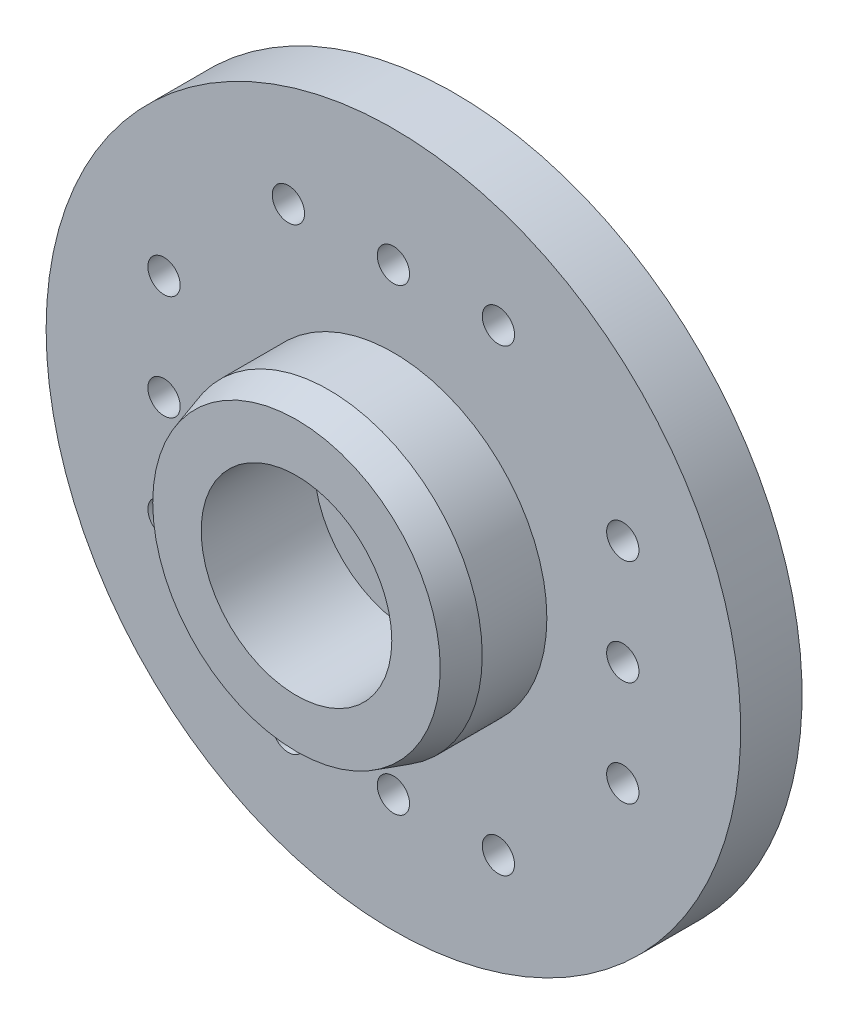
from build123d import *

# Parameters (mm, degrees)
SKETCH1_R           = 10.75
SKETCH1_R_2         = 0.5
BOSS_EXTRUDE1_DEPTH = 1.9
SKETCH2_R           = 4.75
BOSS_EXTRUDE2_DEPTH = 3
SKETCH7_R           = 2.95
CUT_EXTRUDE1_DEPTH  = 3.5
SKETCH8_R           = 3.25
SKETCH8_R_2         = 2.75
BOSS_EXTRUDE3_DEPTH = 1
CUT_EXTRUDE2_START  = -0.4
SKETCH9_R           = 4.25
SKETCH9_R_2         = 3.25
CUT_EXTRUDE2_DEPTH  = 0.4
SKETCH10_R          = 1.45
CUT_EXTRUDE3_DEPTH  = 16.972945877


with BuildPart() as part:
    # Sketch1 → Boss-Extrude1 (new body)
    with BuildSketch(Plane.XY):
        with Locations(Location((0, 0, 0), (0, 0, 180))):
            Circle(SKETCH1_R)
        with Locations((-3.25, 7.1)):
            Circle(SKETCH1_R_2, mode=Mode.SUBTRACT)
        with Locations((0, 7.1)):
            Circle(SKETCH1_R_2, mode=Mode.SUBTRACT)
        with Locations((3.25, 7.1)):
            Circle(SKETCH1_R_2, mode=Mode.SUBTRACT)
        with Locations((7.1, 3.25)):
            Circle(SKETCH1_R_2, mode=Mode.SUBTRACT)
        with Locations((7.1, 0)):
            Circle(SKETCH1_R_2, mode=Mode.SUBTRACT)
        with Locations((7.1, -3.25)):
            Circle(SKETCH1_R_2, mode=Mode.SUBTRACT)
        with Locations((3.25, -7.1)):
            Circle(SKETCH1_R_2, mode=Mode.SUBTRACT)
        with Locations((0, -7.1)):
            Circle(SKETCH1_R_2, mode=Mode.SUBTRACT)
        with Locations((-3.25, -7.1)):
            Circle(SKETCH1_R_2, mode=Mode.SUBTRACT)
        with Locations((-7.1, -3.25)):
            Circle(SKETCH1_R_2, mode=Mode.SUBTRACT)
        with Locations((-7.1, 0)):
            Circle(SKETCH1_R_2, mode=Mode.SUBTRACT)
        with Locations((-7.1, 3.25)):
            Circle(SKETCH1_R_2, mode=Mode.SUBTRACT)
    extrude(amount=BOSS_EXTRUDE1_DEPTH)

    # Sketch2 → Boss-Extrude2 (add)
    with BuildSketch(Plane.XY.offset(1.9)):
        Circle(SKETCH2_R)
    extrude(amount=BOSS_EXTRUDE2_DEPTH)

    # Sketch5 → Cut-Revolve1 (revolve, cut)
    with BuildSketch(Plane(origin=(0, 0, 0), x_dir=(1, 0, 0), z_dir=(0, 1, 0))):
        Polygon((4.75, -3.9), (4.45, -4.9), (4.75, -4.9), align=None)
    revolve(axis=Axis((0, 0, 6.098390295), (0, 0, -1)), mode=Mode.SUBTRACT)

    # Sketch7 → Cut-Extrude1 (cut)
    with BuildSketch(Plane.XY.offset(4.9)):
        Circle(SKETCH7_R)
    extrude(amount=-CUT_EXTRUDE1_DEPTH, mode=Mode.SUBTRACT)

    # Sketch8 → Boss-Extrude3 (add)
    with BuildSketch(Plane(origin=(0, 0, 0), x_dir=(-1, 0, 0), z_dir=(0, 0, -1))):
        with Locations(Location((0, 0, 0), (0, 0, 180))):
            Circle(SKETCH8_R)
        Circle(SKETCH8_R_2, mode=Mode.SUBTRACT)
    extrude(amount=BOSS_EXTRUDE3_DEPTH)

    # Sketch9 → Cut-Extrude2 (cut)
    with BuildSketch(Plane(origin=(0, 0, 0), x_dir=(-1, 0, 0), z_dir=(0, 0, -1)).offset(CUT_EXTRUDE2_START)):
        Circle(SKETCH9_R)
        Circle(SKETCH9_R_2, mode=Mode.SUBTRACT)
    extrude(amount=CUT_EXTRUDE2_DEPTH, mode=Mode.SUBTRACT)

    # Sketch10 → Cut-Extrude3 (cut, through all)
    with BuildSketch(Plane(origin=(0, 0, 0), x_dir=(-1, 0, 0), z_dir=(0, 0, -1))):
        Circle(SKETCH10_R)
    extrude(amount=-CUT_EXTRUDE3_DEPTH, mode=Mode.SUBTRACT)


solid = part.part
